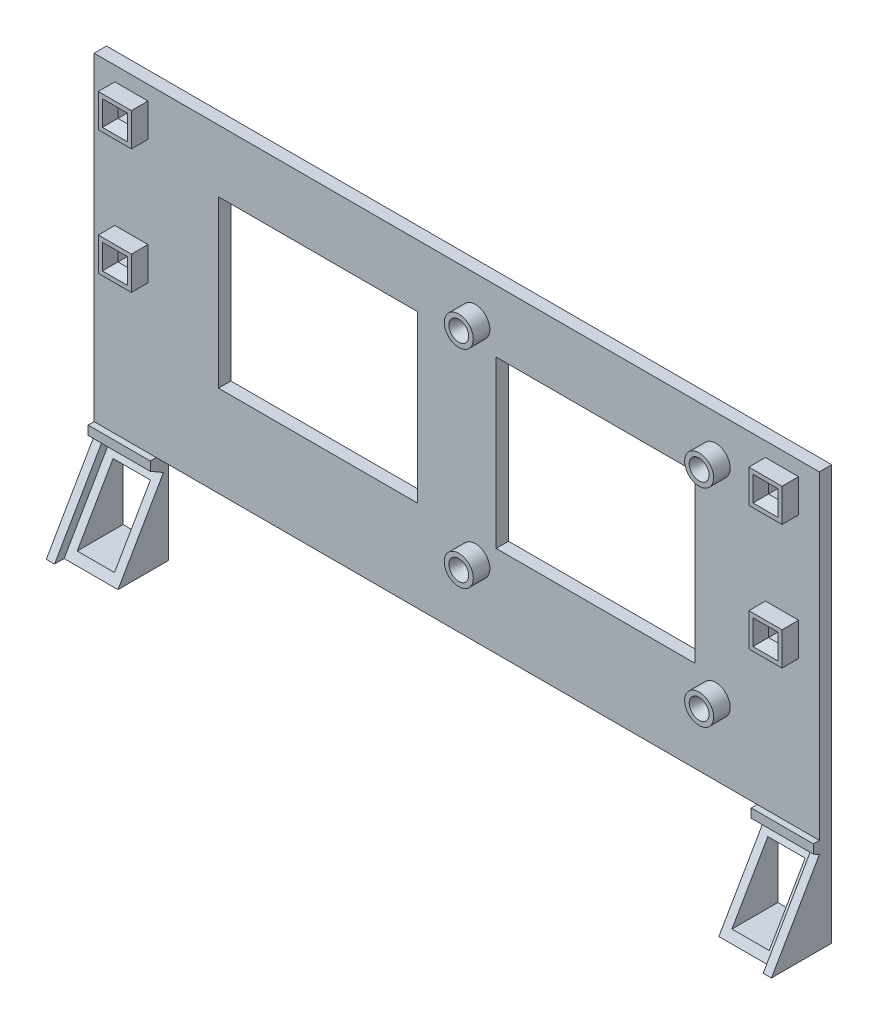
from build123d import *
from OCP.BRepFilletAPI import BRepFilletAPI_MakeChamfer

# Parameters (mm, degrees)
SKETCH_1_W               = 175
SKETCH_1_H               = 100
EXTRUDE_1_DEPTH          = 3
EXTRUDE_3_DEPTH          = 175
EXTRUDE_4_DEPTH          = 175
SKETCH_7_W               = 4.38851426
SKETCH_7_H               = 4.191593749
CUT_EXTRUDE_3_DEPTH      = 185.87600743
SKETCH_8_W               = 171
SKETCH_8_H               = 23.094010767
CUT_EXTRUDE_4_DEPTH      = 2
SKETCH_10_R              = 3.5
SKETCH_10_W              = 8
SKETCH_10_H              = 8
EXTRUDE_6_DEPTH          = 4
CUT_EXTRUDE_6_DEPTH      = 148.543018566
CUT_EXTRUDE_6_DEPTH_BACK = 148.543018566
SKETCH_2_R               = 1.4
SKETCH_11_W              = 145
SKETCH_11_H              = 12.237604307
CUT_EXTRUDE_7_DEPTH      = 23
SKETCH_13_W              = 4
SKETCH_13_H              = 4
CUT_EXTRUDE_8_DEPTH      = 148.283964791
CHAMFER_1_SIZE           = 1
CHAMFER_1_SIZE2          = 2.747477419
CUT_EXTRUDE_9_DEPTH      = 148.543018566
CUT_EXTRUDE_9_DEPTH_BACK = 148.543018566
SKETCH_15_W              = 48
SKETCH_15_H              = 40
SKETCH_15_W_2            = 9
SKETCH_15_H_2            = 15


with BuildPart() as part:
    # 草图1 → 凸台-拉伸1 (new body)
    with BuildSketch(Plane.XY):
        with Locations((-47.751936166, -7.814554894)):
            Rectangle(SKETCH_1_W, SKETCH_1_H)
    extrude(amount=EXTRUDE_1_DEPTH)

    # 草图3 → 凸台-拉伸3 (add, through all)
    with BuildSketch(Plane.ZY.offset(135.251936166)):
        Polygon((3, -57.814554894), (14.547005384, -57.814554894), (3, -37.814554894), align=None)
    extrude(amount=-EXTRUDE_3_DEPTH)

    # 草图5 → 凸台-拉伸4 (add, through all)
    with BuildSketch(Plane.ZY.offset(135.251936166)):
        Polygon((3, -37.814554894), (3, -34.814554894), (8.196152423, -34.814554894), align=None)
    extrude(amount=-EXTRUDE_4_DEPTH)

    # 草图7 → 切除-拉伸3 (cut, through all)
    with BuildSketch(Plane.ZY.offset(135.251936166)):
        with Locations((6.645542678, -35.647071791)):
            Rectangle(SKETCH_7_W, SKETCH_7_H)
    extrude(amount=-CUT_EXTRUDE_3_DEPTH, mode=Mode.SUBTRACT)

    # 草图8 → 切除-拉伸4 (cut)
    with BuildSketch(Plane(origin=(0, -8.154600618, -14.124182585), x_dir=(1, 0, 0), z_dir=(0, 0.49999999999999506, 0.8660254037844415))):
        with Locations((-47.751936166, -45.795370555)):
            Rectangle(SKETCH_8_W, SKETCH_8_H)
    extrude(amount=-CUT_EXTRUDE_4_DEPTH, mode=Mode.SUBTRACT)

    # 草图10 → 凸台-拉伸6 (add)
    with BuildSketch(Plane.XY.offset(3)):
        with Locations((-43.251936166, 32.185445106)):
            Circle(SKETCH_10_R)
        with Locations((14.748063834, 32.185445106)):
            Circle(SKETCH_10_R)
        with Locations((-43.251936166, -17.814554894)):
            Circle(SKETCH_10_R)
        with Locations((14.748063834, -17.814554894)):
            Circle(SKETCH_10_R)
        with Locations((-126.251936166, 34.685445106)):
            Rectangle(SKETCH_10_W, SKETCH_10_H)
        with Locations((30.748063834, 34.685445106)):
            Rectangle(SKETCH_10_W, SKETCH_10_H)
        with Locations((-126.251936166, 4.685445106)):
            Rectangle(SKETCH_10_W, SKETCH_10_H)
        with Locations((30.748063834, 4.685445106)):
            Rectangle(SKETCH_10_W, SKETCH_10_H)
    extrude(amount=EXTRUDE_6_DEPTH)

    # 草图2 → 切除-拉伸6 (cut, two sides: drawn at the far end of the back side and taken through both)
    with BuildSketch(Plane.XY.offset(3).offset(-CUT_EXTRUDE_6_DEPTH_BACK)):
        with Locations((-43.251936166, 32.185445106)):
            Circle(SKETCH_2_R)
        with Locations((14.748063834, 32.185445106)):
            Circle(SKETCH_2_R)
        with Locations((14.748063834, -17.814554894)):
            Circle(SKETCH_2_R)
        with Locations((-43.251936166, -17.814554894)):
            Circle(SKETCH_2_R)
    extrude(amount=CUT_EXTRUDE_6_DEPTH + CUT_EXTRUDE_6_DEPTH_BACK, mode=Mode.SUBTRACT)

    # 草图11 → 切除-拉伸7 (cut)
    with BuildSketch(Plane.XZ.offset(57.814554894)):
        with Locations((-47.751936166, 6.118802154)):
            Rectangle(SKETCH_11_W, SKETCH_11_H)
    extrude(amount=-CUT_EXTRUDE_7_DEPTH, mode=Mode.SUBTRACT)

    # 草图13 → 切除-拉伸8 (cut, through all)
    with BuildSketch(Plane.XY.offset(7)):
        with Locations((-126.251936166, 34.685445106)):
            Rectangle(SKETCH_13_W, SKETCH_13_H)
        with Locations((30.748063834, 34.685445106)):
            Rectangle(SKETCH_13_W, SKETCH_13_H)
        with Locations((-126.251936166, 4.685445106)):
            Rectangle(SKETCH_13_W, SKETCH_13_H)
        with Locations((30.748063834, 4.685445106)):
            Rectangle(SKETCH_13_W, SKETCH_13_H)
    extrude(amount=-CUT_EXTRUDE_8_DEPTH, mode=Mode.SUBTRACT)

    # 倒角1: one chamfer whose edges measure the first distance from different faces: ONE call of the kernel's chamfer builder (chamfer() names one face for all edges)
    chamfer_1_edges_1 = [part.edges().sort_by_distance(p)[0] for p in [
        (13.348063834, 32.185445106, 7),
    ]]
    chamfer_1_side_1 = [part.faces().sort_by_distance(p)[0] for p in [
        (11.347058783, 32.185445106, 7),
    ]]
    chamfer_1_edges_2 = [part.edges().sort_by_distance(p)[0] for p in [
        (-44.651936166, -17.814554894, 7),
    ]]
    chamfer_1_side_2 = [part.faces().sort_by_distance(p)[0] for p in [
        (-46.652941217, -17.814554894, 7),
    ]]
    chamfer_1_edges_3 = [part.edges().sort_by_distance(p)[0] for p in [
        (13.348063834, -17.814554894, 7),
    ]]
    chamfer_1_side_3 = [part.faces().sort_by_distance(p)[0] for p in [
        (11.347058783, -17.814554894, 7),
    ]]
    chamfer_1_edges_4 = [part.edges().sort_by_distance(p)[0] for p in [
        (-44.651936166, 32.185445106, 7),
    ]]
    chamfer_1_side_4 = [part.faces().sort_by_distance(p)[0] for p in [
        (-46.652941217, 32.185445106, 7),
    ]]
    chamfer_1_edges_5 = [part.edges().sort_by_distance(p)[0] for p in [
        (30.748063834, 36.685445106, 7),
        (28.748063834, 34.685445106, 7),
        (30.748063834, 32.685445106, 7),
        (32.748063834, 34.685445106, 7),
    ]]
    chamfer_1_side_5 = [part.faces().sort_by_distance(p)[0] for p in [
        (26.861200919, 34.685445106, 7),
    ]]
    chamfer_1_edges_6 = [part.edges().sort_by_distance(p)[0] for p in [
        (-126.251936166, 6.685445106, 7),
        (-128.251936166, 4.685445106, 7),
        (-126.251936166, 2.685445106, 7),
        (-124.251936166, 4.685445106, 7),
    ]]
    chamfer_1_side_6 = [part.faces().sort_by_distance(p)[0] for p in [
        (-130.138799081, 4.685445106, 7),
    ]]
    chamfer_1_edges_7 = [part.edges().sort_by_distance(p)[0] for p in [
        (30.748063834, 6.685445106, 7),
        (28.748063834, 4.685445106, 7),
        (30.748063834, 2.685445106, 7),
        (32.748063834, 4.685445106, 7),
    ]]
    chamfer_1_side_7 = [part.faces().sort_by_distance(p)[0] for p in [
        (26.861200919, 4.685445106, 7),
    ]]
    chamfer_1_edges_8 = [part.edges().sort_by_distance(p)[0] for p in [
        (-128.251936166, 34.685445106, 7),
        (-126.251936166, 32.685445106, 7),
        (-124.251936166, 34.685445106, 7),
        (-126.251936166, 36.685445106, 7),
    ]]
    chamfer_1_side_8 = [part.faces().sort_by_distance(p)[0] for p in [
        (-126.251936166, 38.572308021, 7),
    ]]
    chamfer_1 = BRepFilletAPI_MakeChamfer(part.part.solid().wrapped)
    for e in chamfer_1_edges_1:
        chamfer_1.Add(CHAMFER_1_SIZE, CHAMFER_1_SIZE2, e.wrapped, chamfer_1_side_1[0].wrapped)  # the first distance lies on this face
    for e in chamfer_1_edges_2:
        chamfer_1.Add(CHAMFER_1_SIZE, CHAMFER_1_SIZE2, e.wrapped, chamfer_1_side_2[0].wrapped)  # the first distance lies on this face
    for e in chamfer_1_edges_3:
        chamfer_1.Add(CHAMFER_1_SIZE, CHAMFER_1_SIZE2, e.wrapped, chamfer_1_side_3[0].wrapped)  # the first distance lies on this face
    for e in chamfer_1_edges_4:
        chamfer_1.Add(CHAMFER_1_SIZE, CHAMFER_1_SIZE2, e.wrapped, chamfer_1_side_4[0].wrapped)  # the first distance lies on this face
    for e in chamfer_1_edges_5:
        chamfer_1.Add(CHAMFER_1_SIZE, CHAMFER_1_SIZE2, e.wrapped, chamfer_1_side_5[0].wrapped)  # the first distance lies on this face
    for e in chamfer_1_edges_6:
        chamfer_1.Add(CHAMFER_1_SIZE, CHAMFER_1_SIZE2, e.wrapped, chamfer_1_side_6[0].wrapped)  # the first distance lies on this face
    for e in chamfer_1_edges_7:
        chamfer_1.Add(CHAMFER_1_SIZE, CHAMFER_1_SIZE2, e.wrapped, chamfer_1_side_7[0].wrapped)  # the first distance lies on this face
    for e in chamfer_1_edges_8:
        chamfer_1.Add(CHAMFER_1_SIZE, CHAMFER_1_SIZE2, e.wrapped, chamfer_1_side_8[0].wrapped)  # the first distance lies on this face
    add(Compound.cast(chamfer_1.Shape()), mode=Mode.REPLACE)

    # 草图15 → 切除-拉伸9 (cut, two sides: drawn at the far end of the back side and taken through both)
    with BuildSketch(Plane.XY.offset(3).offset(-CUT_EXTRUDE_9_DEPTH_BACK)):
        with Locations((-81.251936166, 7.185445106)):
            Rectangle(SKETCH_15_W, SKETCH_15_H)
        with Locations((-14.251936166, 7.185445106)):
            Rectangle(SKETCH_15_W, SKETCH_15_H)
        with Locations((-126.751936166, -48.314554894)):
            Rectangle(SKETCH_15_W_2, SKETCH_15_H_2)
        with Locations((31.248063834, -48.314554894)):
            Rectangle(SKETCH_15_W_2, SKETCH_15_H_2)
    extrude(amount=CUT_EXTRUDE_9_DEPTH + CUT_EXTRUDE_9_DEPTH_BACK, mode=Mode.SUBTRACT)


solid = part.part
